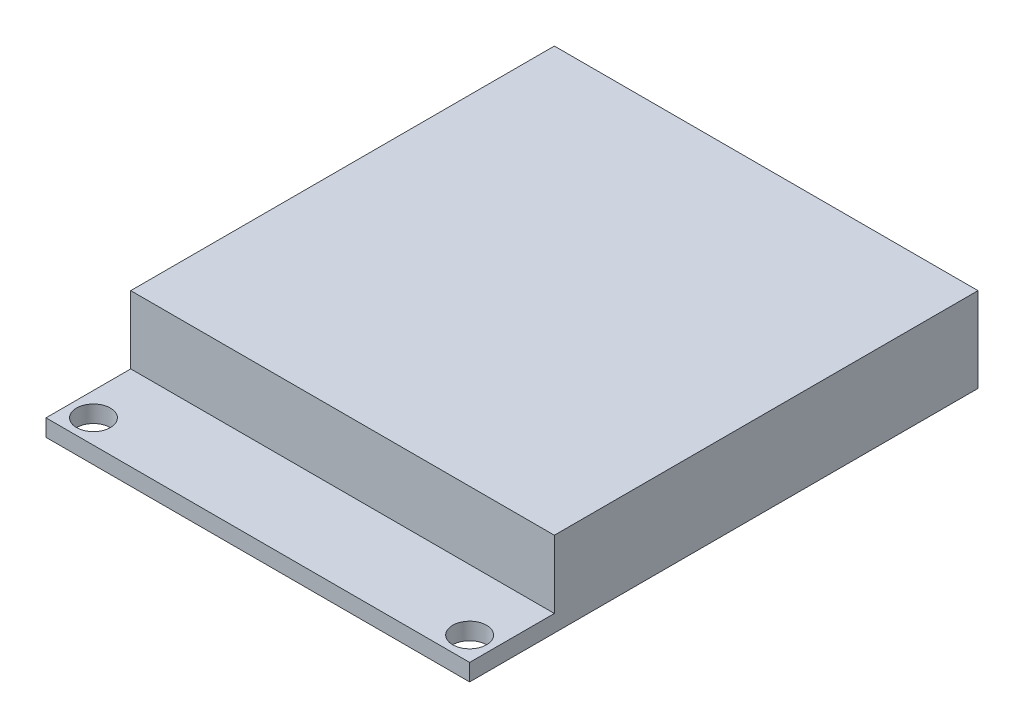
from build123d import *

# Parameters (mm, degrees)
SKETCH_1_W          = 25
SKETCH_1_H          = 30
EXTRUDE_1_DEPTH     = 1
SKETCH_2_W          = 25
SKETCH_2_H          = 25
EXTRUDE_2_DEPTH     = 4
SKETCH_3_R          = 1
CUT_EXTRUDE_1_DEPTH = 1


with BuildPart() as part:
    # 草图1 → 凸台-拉伸1 (new body)
    with BuildSketch(Plane(origin=(0, 0, 0), x_dir=(1, 0, 0), z_dir=(0, 1, 0))):
        Rectangle(SKETCH_1_W, SKETCH_1_H)
    extrude(amount=EXTRUDE_1_DEPTH)

    # 草图2 → 凸台-拉伸2 (add)
    with BuildSketch(Plane(origin=(0, 1, 0), x_dir=(1, 0, 0), z_dir=(0, 1, 0))):
        with Locations((0, 2.5)):
            Rectangle(SKETCH_2_W, SKETCH_2_H)
    extrude(amount=EXTRUDE_2_DEPTH)

    # 草图3 → 切除-拉伸1 (cut)
    with BuildSketch(Plane(origin=(0, 1, 0), x_dir=(1, 0, 0), z_dir=(0, 1, 0))):
        with Locations(Location((-11.1, -13.6, 0), (0, 0, 270))):
            Circle(SKETCH_3_R)
        with Locations(Location((11.1, -13.6, 0), (0, 0, 270))):
            Circle(SKETCH_3_R)
    extrude(amount=-CUT_EXTRUDE_1_DEPTH, mode=Mode.SUBTRACT)


solid = part.part
